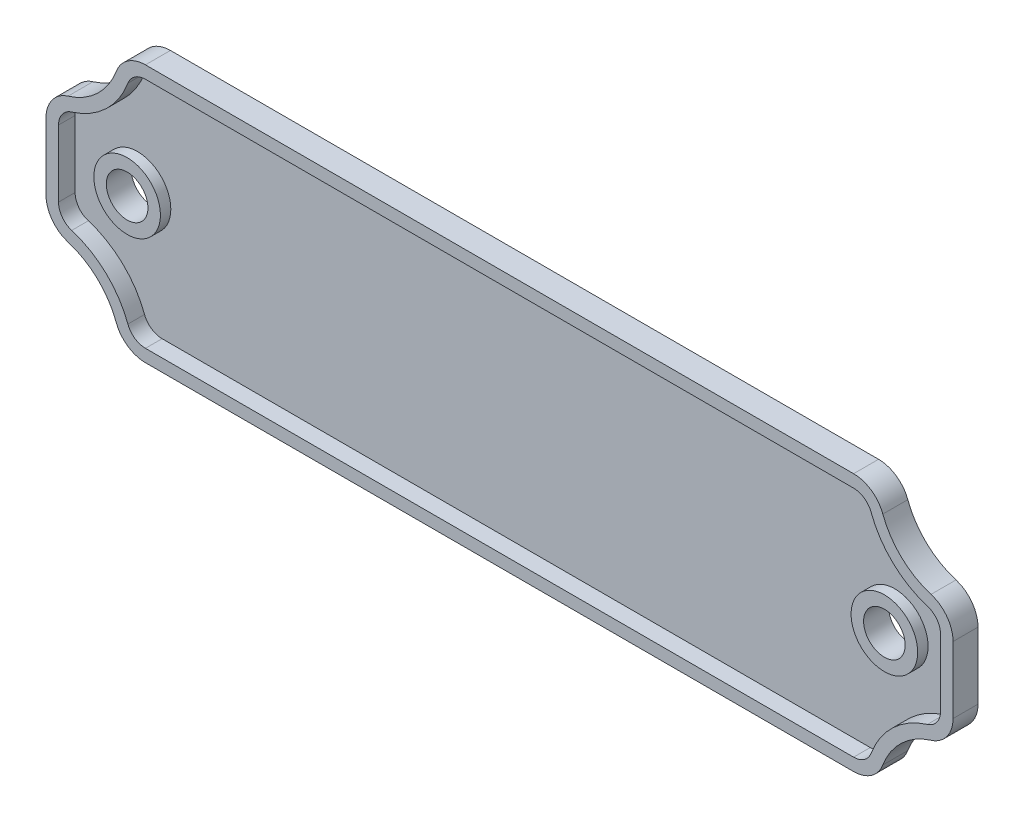
from build123d import *

# Parameters (mm, degrees)
NAME_PLATE_BEZEL_DEPTH     = 3
NAME_PLATE_BACKPLATE_DEPTH = 1
HOLE_BEZEL_DEPTH           = 2.25
HOLE_BEZEL_DEPTH_BACK      = 0.75
HOLE_SKETCH_R              = 4
HOLE_SKETCH_R_2            = 2.5
HOLE_CUTOUT_DEPTH          = 57.740637994
HOLE_CUTOUT_DEPTH_BACK     = 57.740637994
HOLE_SKETCH_6_R            = 2.5


with BuildPart() as part:
    # Base Plate Sketch → Name Plate Bezel (new body)
    with BuildSketch(Plane.XY):
        with BuildLine():
            Line((-42.549751124, 15.5), (42.549751124, 15.5))
            ThreePointArc((42.549751124, 15.5), (44.689893576, 14.829332766), (46.064530205, 13.057221485))
            ThreePointArc((46.064530205, 13.057221485), (48.321727581, 9.650169967), (51.852941176, 7.592630032))
            ThreePointArc((51.852941176, 7.592630032), (53.76649875, 6.236327413), (54.5, 4.008495442))
            Line((54.5, 4.008495442), (54.5, -4.008495442))
            ThreePointArc((54.5, -4.008495442), (53.76649875, -6.236327413), (51.852941176, -7.592630032))
            ThreePointArc((51.852941176, -7.592630032), (48.321727581, -9.650169967), (46.064530205, -13.057221485))
            ThreePointArc((46.064530205, -13.057221485), (44.689893576, -14.829332766), (42.549751124, -15.5))
            Line((42.549751124, -15.5), (-42.549751124, -15.5))
            ThreePointArc((-42.549751124, -15.5), (-44.689893576, -14.829332766), (-46.064530205, -13.057221485))
            ThreePointArc((-46.064530205, -13.057221485), (-48.321727581, -9.650169967), (-51.852941176, -7.592630032))
            ThreePointArc((-51.852941176, -7.592630032), (-53.76649875, -6.236327413), (-54.5, -4.008495442))
            Line((-54.5, -4.008495442), (-54.5, 4.008495442))
            ThreePointArc((-54.5, 4.008495442), (-53.76649875, 6.236327413), (-51.852941176, 7.592630032))
            ThreePointArc((-51.852941176, 7.592630032), (-48.321727581, 9.650169967), (-46.064530205, 13.057221485))
            ThreePointArc((-46.064530205, 13.057221485), (-44.689893576, 14.829332766), (-42.549751124, 15.5))
        make_face()
        with BuildLine():
            Line((-42.549751124, 14), (42.549751124, 14))
            ThreePointArc((42.549751124, 14), (43.833836595, 13.59759966), (44.658618573, 12.534332891))
            ThreePointArc((44.658618573, 12.534332891), (47.292015511, 8.559439453), (51.411764706, 6.158976196))
            ThreePointArc((51.411764706, 6.158976196), (52.55989925, 5.345194625), (53, 4.008495442))
            Line((53, 4.008495442), (53, -4.008495442))
            ThreePointArc((53, -4.008495442), (52.55989925, -5.345194625), (51.411764706, -6.158976196))
            ThreePointArc((51.411764706, -6.158976196), (47.292015511, -8.559439453), (44.658618573, -12.534332891))
            ThreePointArc((44.658618573, -12.534332891), (43.833836595, -13.59759966), (42.549751124, -14))
            Line((42.549751124, -14), (-42.549751124, -14))
            ThreePointArc((-42.549751124, -14), (-43.833836595, -13.59759966), (-44.658618573, -12.534332891))
            ThreePointArc((-44.658618573, -12.534332891), (-47.292015511, -8.559439453), (-51.411764706, -6.158976196))
            ThreePointArc((-51.411764706, -6.158976196), (-52.55989925, -5.345194625), (-53, -4.008495442))
            Line((-53, -4.008495442), (-53, 4.008495442))
            ThreePointArc((-53, 4.008495442), (-52.55989925, 5.345194625), (-51.411764706, 6.158976196))
            ThreePointArc((-51.411764706, 6.158976196), (-47.292015511, 8.559439453), (-44.658618573, 12.534332891))
            ThreePointArc((-44.658618573, 12.534332891), (-43.833836595, 13.59759966), (-42.549751124, 14))
        make_face(mode=Mode.SUBTRACT)
    extrude(amount=NAME_PLATE_BEZEL_DEPTH)

    # Sketch1<6> → Name Plate Backplate (add)
    with BuildSketch(Plane.XY):
        with BuildLine():
            Line((-42.549751124, 15.5), (42.549751124, 15.5))
            ThreePointArc((42.549751124, 15.5), (44.689893576, 14.829332766), (46.064530205, 13.057221485))
            ThreePointArc((46.064530205, 13.057221485), (48.321727581, 9.650169967), (51.852941176, 7.592630032))
            ThreePointArc((51.852941176, 7.592630032), (53.76649875, 6.236327413), (54.5, 4.008495442))
            Line((54.5, 4.008495442), (54.5, -4.008495442))
            ThreePointArc((54.5, -4.008495442), (53.76649875, -6.236327413), (51.852941176, -7.592630032))
            ThreePointArc((51.852941176, -7.592630032), (48.321727581, -9.650169967), (46.064530205, -13.057221485))
            ThreePointArc((46.064530205, -13.057221485), (44.689893576, -14.829332766), (42.549751124, -15.5))
            Line((42.549751124, -15.5), (-42.549751124, -15.5))
            ThreePointArc((-42.549751124, -15.5), (-44.689893576, -14.829332766), (-46.064530205, -13.057221485))
            ThreePointArc((-46.064530205, -13.057221485), (-48.321727581, -9.650169967), (-51.852941176, -7.592630032))
            ThreePointArc((-51.852941176, -7.592630032), (-53.76649875, -6.236327413), (-54.5, -4.008495442))
            Line((-54.5, -4.008495442), (-54.5, 4.008495442))
            ThreePointArc((-54.5, 4.008495442), (-53.76649875, 6.236327413), (-51.852941176, 7.592630032))
            ThreePointArc((-51.852941176, 7.592630032), (-48.321727581, 9.650169967), (-46.064530205, 13.057221485))
            ThreePointArc((-46.064530205, 13.057221485), (-44.689893576, 14.829332766), (-42.549751124, 15.5))
        make_face()
    extrude(amount=NAME_PLATE_BACKPLATE_DEPTH)

    # Hole Sketch → Hole Bezel (add, two sides: drawn at the far end of the back side and taken through both)
    # profile 1 of 2: a face of its own
    with BuildSketch(Plane.XY.offset(-HOLE_BEZEL_DEPTH_BACK)):
        with Locations((45.5, 0)):
            Circle(HOLE_SKETCH_R)
        with Locations((45.5, 0)):
            Circle(HOLE_SKETCH_R_2, mode=Mode.SUBTRACT)
    # profile 2 of 2: a face of its own
    with BuildSketch(Plane.XY.offset(-HOLE_BEZEL_DEPTH_BACK)):
        with Locations((-45.5, 0)):
            Circle(HOLE_SKETCH_R)
        with Locations((-45.5, 0)):
            Circle(HOLE_SKETCH_R_2, mode=Mode.SUBTRACT)
    extrude(amount=HOLE_BEZEL_DEPTH + HOLE_BEZEL_DEPTH_BACK)

    # Hole Sketch<6> → Hole Cutout (cut, two sides: drawn at the far end of the back side and taken through both)
    with BuildSketch(Plane.XY.offset(-HOLE_CUTOUT_DEPTH_BACK)):
        with Locations((-45.5, 0)):
            Circle(HOLE_SKETCH_6_R)
        with Locations((45.5, 0)):
            Circle(HOLE_SKETCH_6_R)
    extrude(amount=HOLE_CUTOUT_DEPTH + HOLE_CUTOUT_DEPTH_BACK, mode=Mode.SUBTRACT)


solid = part.part
